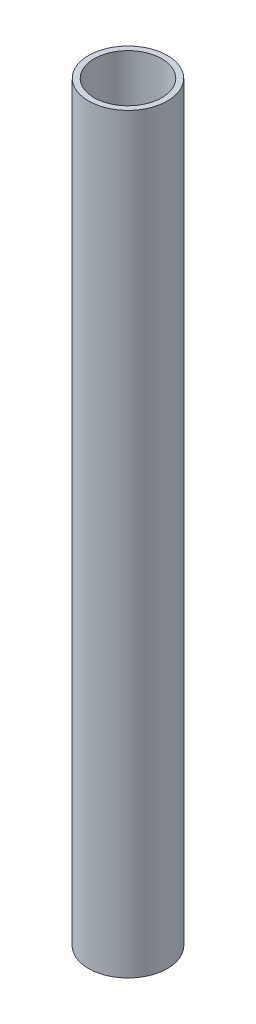
from build123d import *

# Parameters (mm, degrees)
SKETCH_1_R      = 5.25
EXTRUDE_1_DEPTH = 50
M10X1_0_1_D     = 9


with BuildPart() as part:
    # 草图1 → 凸台-拉伸1 (new, symmetric)
    with BuildSketch(Plane(origin=(0, 0, 0), x_dir=(1, 0, 0), z_dir=(0, 1, 0))):
        with Locations(Location((0, 0, 0), (0, 0, 270))):
            Circle(SKETCH_1_R)
    extrude(amount=EXTRUDE_1_DEPTH, both=True)

    # M10x1.0 螺纹孔1 (through all)
    with Locations(Plane.ZX.offset(50)):
        with Locations((0, 0)):
            Hole(M10X1_0_1_D / 2)


solid = part.part
